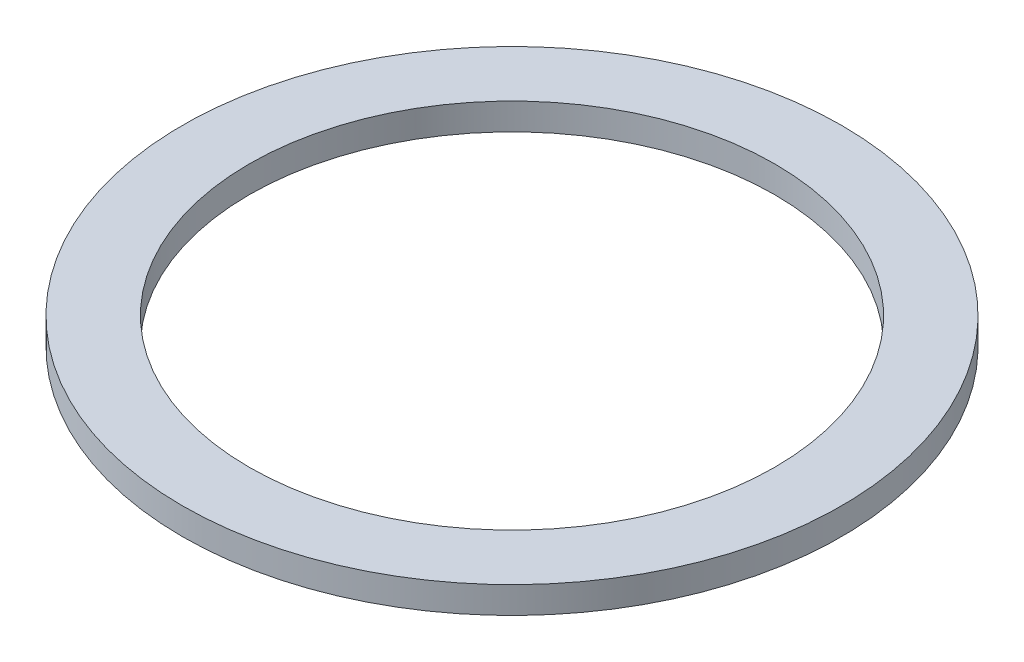
from build123d import *

# Parameters (mm, degrees)
PROFILES_R    = 14.8
PROFILES_R_2  = 11.8
PROFILE_DEPTH = 0.6


with BuildPart() as part:
    # ProfileS → Profile (new, symmetric)
    with BuildSketch(Plane(origin=(0, 0, 0), x_dir=(1, 0, 0), z_dir=(0, 1, 0))):
        with Locations(Location((0, 0, 0), (0, 0, 270))):
            Circle(PROFILES_R)
        with Locations(Location((0, 0, 0), (0, 0, 270))):
            Circle(PROFILES_R_2, mode=Mode.SUBTRACT)
    extrude(amount=PROFILE_DEPTH, both=True)


solid = part.part
